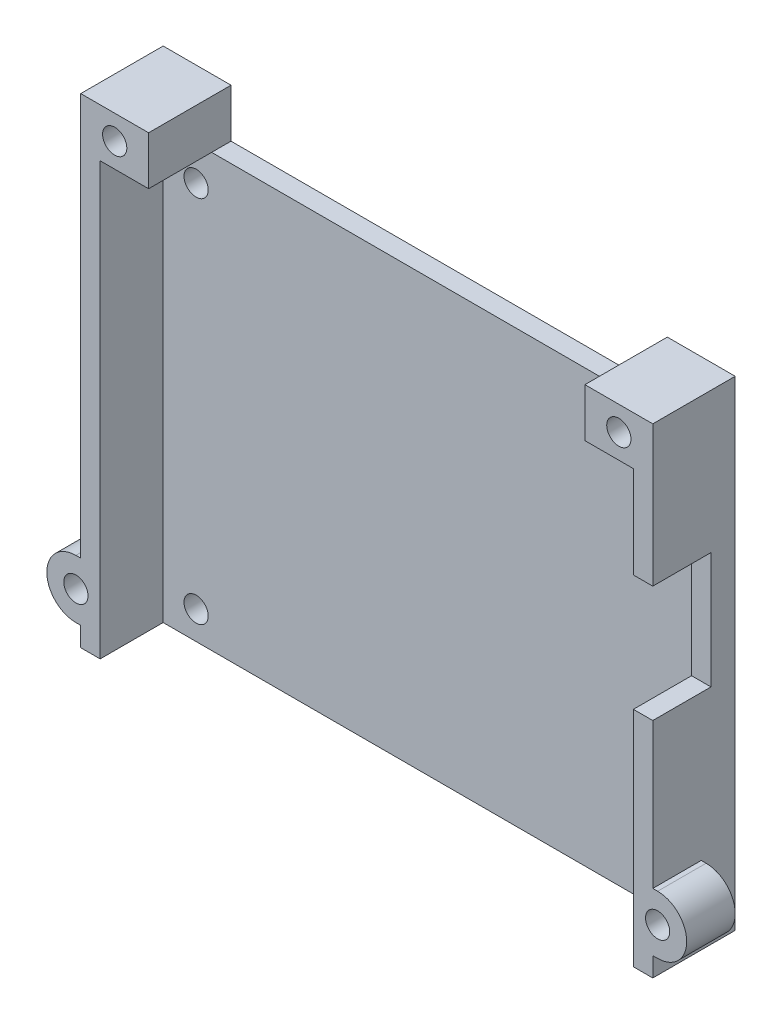
from build123d import *

# Parameters (mm, degrees)
BOSS_EXTRUDE1_DEPTH = 44.5
SKETCH2_W           = 6
SKETCH2_H           = 12
CUT_EXTRUDE1_DEPTH  = 10
BOSS_EXTRUDE2_DEPTH = 8.5
CUT_EXTRUDE2_DEPTH  = 11
SKETCH4_W           = 7
SKETCH4_H           = 8.5
BOSS_EXTRUDE3_DEPTH = 5
SKETCH5_R           = 1.25
CUT_EXTRUDE3_DEPTH  = 81.179486155
SKETCH7_R           = 1.25
CUT_EXTRUDE4_DEPTH  = 10
CUT_EXTRUDE6_DEPTH  = 3.5
BOSS_EXTRUDE4_DEPTH = 3


with BuildPart() as part:
    # Sketch1 → Boss-Extrude1 (new body)
    with BuildSketch(Plane(origin=(0, 0, 0), x_dir=(1, 0, 0), z_dir=(0, 1, 0))):
        Polygon((0, 0), (2, 0), (2, 6.5), (57, 6.5), (57, 0), (59, 0), (59, 8.5), (0, 8.5), align=None)
    extrude(amount=BOSS_EXTRUDE1_DEPTH)

    # Sketch2 → Cut-Extrude1 (cut)
    with BuildSketch(Plane(origin=(59, 0, 0), x_dir=(0, 0, -1), z_dir=(1, 0, 0))):
        with Locations((3, 29)):
            Rectangle(SKETCH2_W, SKETCH2_H)
    extrude(amount=-CUT_EXTRUDE1_DEPTH, mode=Mode.SUBTRACT)

    # Sketch3 → Boss-Extrude2 (add)
    with BuildSketch(Plane(origin=(0, 0, -8.5), x_dir=(-1, 0, 0), z_dir=(0, 0, -1))):
        with BuildLine():
            Line((-59, 6.145643924), (-59, 8))
            Line((-59, 8), (-59.5, 8))
            ThreePointArc((-59.5, 8), (-62.5, 5), (-59.5, 2))
            Line((-59.5, 2), (-59, 2))
            Line((-59, 2), (-59, 3.854356076))
            ThreePointArc((-59, 3.854356076), (-60.75, 5), (-59, 6.145643924))
        make_face()
        with BuildLine():
            Line((0.5, 8), (0, 8))
            Line((0, 8), (0, 6.145643924))
            ThreePointArc((0, 6.145643924), (1.75, 5), (0, 3.854356076))
            Line((0, 3.854356076), (0, 2))
            Line((0, 2), (0.5, 2))
            ThreePointArc((0.5, 2), (3.5, 5), (0.5, 8))
        make_face()
    extrude(amount=-BOSS_EXTRUDE2_DEPTH)

    # Sketch3<3> → Cut-Extrude2 (cut)
    with BuildSketch(Plane(origin=(0, 0, -8.5), x_dir=(-1, 0, 0), z_dir=(0, 0, -1))):
        with BuildLine():
            ThreePointArc((-59, 3.854356076), (-58.25, 5), (-59, 6.145643924))
            Line((-59, 6.145643924), (-59, 3.854356076))
        make_face()
        with BuildLine():
            Line((0, 3.854356076), (0, 6.145643924))
            ThreePointArc((0, 6.145643924), (-0.75, 5), (0, 3.854356076))
        make_face()
    extrude(amount=-CUT_EXTRUDE2_DEPTH, mode=Mode.SUBTRACT)

    # Sketch4 → Boss-Extrude3 (add)
    with BuildSketch(Plane(origin=(0, 44.5, 0), x_dir=(1, 0, 0), z_dir=(0, 1, 0))):
        with Locations((3.5, 4.25)):
            Rectangle(SKETCH4_W, SKETCH4_H)
        with Locations((55.5, 4.25)):
            Rectangle(SKETCH4_W, SKETCH4_H)
    extrude(amount=BOSS_EXTRUDE3_DEPTH)

    # Sketch5 → Cut-Extrude3 (cut, through all)
    with BuildSketch(Plane(origin=(0, 0, -8.5), x_dir=(-1, 0, 0), z_dir=(0, 0, -1))):
        with Locations((-55.5, 47)):
            Circle(SKETCH5_R)
        with Locations((-3.5, 47)):
            Circle(SKETCH5_R)
    extrude(amount=-CUT_EXTRUDE3_DEPTH, mode=Mode.SUBTRACT)

    # Sketch7 → Cut-Extrude4 (cut)
    with BuildSketch(Plane(origin=(0, 0, -8.5), x_dir=(-1, 0, 0), z_dir=(0, 0, -1))):
        with Locations((-5.4, 2.9)):
            Circle(SKETCH7_R)
        with Locations((-53.6, 2.9)):
            Circle(SKETCH7_R)
        with Locations((-53.6, 40.95)):
            Circle(SKETCH7_R)
        with Locations((-5.4, 40.95)):
            Circle(SKETCH7_R)
    extrude(amount=-CUT_EXTRUDE4_DEPTH, mode=Mode.SUBTRACT)

    # Sketch3<4> → Cut-Extrude6 (cut)
    with BuildSketch(Plane(origin=(0, 0, -8.5), x_dir=(-1, 0, 0), z_dir=(0, 0, -1))):
        with BuildLine():
            Line((-59, 6.145643924), (-59, 8))
            Line((-59, 8), (-59.5, 8))
            ThreePointArc((-59.5, 8), (-62.5, 5), (-59.5, 2))
            Line((-59.5, 2), (-59, 2))
            Line((-59, 2), (-59, 3.854356076))
            ThreePointArc((-59, 3.854356076), (-60.75, 5), (-59, 6.145643924))
        make_face()
        with BuildLine():
            Line((0.5, 8), (0, 8))
            Line((0, 8), (0, 6.145643924))
            ThreePointArc((0, 6.145643924), (1.75, 5), (0, 3.854356076))
            Line((0, 3.854356076), (0, 2))
            Line((0, 2), (0.5, 2))
            ThreePointArc((0.5, 2), (3.5, 5), (0.5, 8))
        make_face()
    extrude(amount=-CUT_EXTRUDE6_DEPTH, mode=Mode.SUBTRACT)

    # Sketch3<5> → Boss-Extrude4 (add)
    with BuildSketch(Plane(origin=(0, 0, -8.5), x_dir=(-1, 0, 0), z_dir=(0, 0, -1))):
        with BuildLine():
            ThreePointArc((-59, 3.854356076), (-58.25, 5), (-59, 6.145643924))
            Line((-59, 6.145643924), (-59, 3.854356076))
        make_face()
        with BuildLine():
            Line((0, 3.854356076), (0, 6.145643924))
            ThreePointArc((0, 6.145643924), (-0.75, 5), (0, 3.854356076))
        make_face()
    extrude(amount=-BOSS_EXTRUDE4_DEPTH)


solid = part.part
